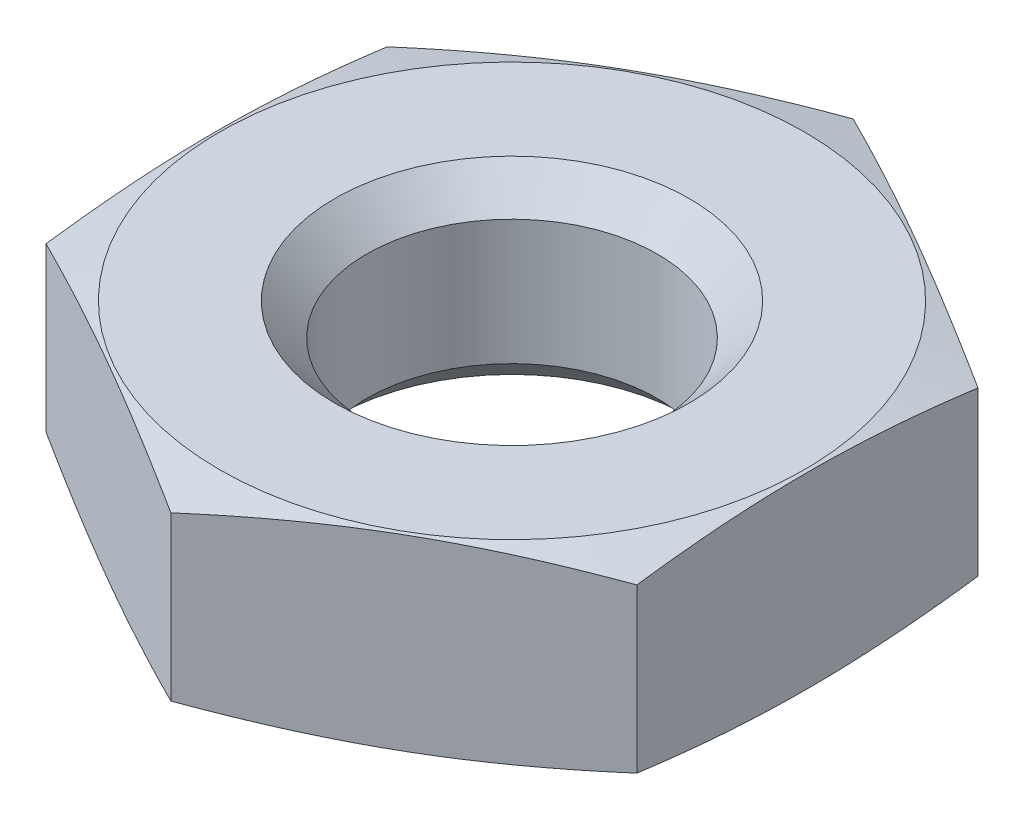
from build123d import *

# Parameters (mm, degrees)
SCHNITT_LINEAR_AUSTRAGEN1_DEPTH      = 4.2
SCHNITT_LINEAR_AUSTRAGEN1_DEPTH_BACK = 4.2
SKIZZE2_W                            = 40
SKIZZE2_H                            = 40


with BuildPart() as part:
    # Skizze1 → Rotation1 (revolve)
    with BuildSketch(Plane.XY):
        Polygon((0, 0), (4.95, 0), (10.921281292, -1.6), (4.95, -3.2), (0, -3.2), align=None)
    revolve(axis=Axis((0, -3.2, 0), (0, 1, 0)))

    # Skizze2 → Schnitt-Linear austragen1 (cut, two sides: drawn at the far end of the back side and taken through both)
    with BuildSketch(Plane(origin=(0, 0, 0), x_dir=(1, 0, 0), z_dir=(0, 1, 0)).offset(-SCHNITT_LINEAR_AUSTRAGEN1_DEPTH_BACK)):
        Rectangle(SKIZZE2_W, SKIZZE2_H)
        Polygon((-5, -2.886751346), (0, -5.773502692), (5, -2.886751346), (5, 2.886751346), (0, 5.773502692), (-5, 2.886751346), align=None, mode=Mode.SUBTRACT)
    extrude(amount=SCHNITT_LINEAR_AUSTRAGEN1_DEPTH + SCHNITT_LINEAR_AUSTRAGEN1_DEPTH_BACK, mode=Mode.SUBTRACT)

    # Skizze3 → Schnitt-Rotation1 (revolve, cut)
    with BuildSketch(Plane.XY):
        Polygon((0, 0), (3, 0), (2.4585, -0.5415), (2.4585, -2.6585), (3, -3.2), (0, -3.2), align=None)
    revolve(axis=Axis((0, -3.2, 0), (0, 1, 0)), mode=Mode.SUBTRACT)


solid = part.part
